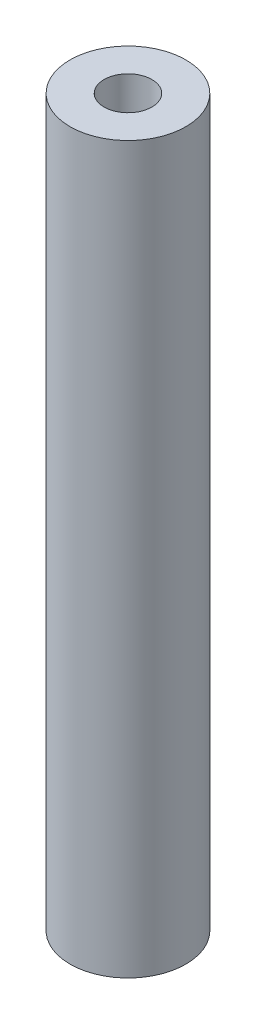
from build123d import *

# Parameters (mm, degrees)
SKETCH1_R           = 4
BOSS_EXTRUDE2_DEPTH = 50.1
SKETCH2_R           = 1.65
CUT_EXTRUDE1_DEPTH  = 8
CUT_EXTRUDE2_START  = -8
SKETCH3_R           = 1.65
CUT_EXTRUDE2_DEPTH  = 8


with BuildPart() as part:
    # Sketch1 → Boss-Extrude2 (new body)
    with BuildSketch(Plane(origin=(0, 0, 0), x_dir=(1, 0, 0), z_dir=(0, 1, 0))):
        with Locations(Location((0, 0, 0), (0, 0, 270))):
            Circle(SKETCH1_R)
    extrude(amount=BOSS_EXTRUDE2_DEPTH)

    # Sketch2 → Cut-Extrude1 (cut)
    with BuildSketch(Plane(origin=(0, 50.1, 0), x_dir=(1, 0, 0), z_dir=(0, 1, 0))):
        with Locations(Location((0, 0, 0), (0, 0, 270))):
            Circle(SKETCH2_R)
    extrude(amount=-CUT_EXTRUDE1_DEPTH, mode=Mode.SUBTRACT)

    # Sketch3 → Cut-Extrude2 (cut)
    with BuildSketch(Plane.XZ.offset(CUT_EXTRUDE2_START)):
        with Locations(Location((0, 0, 0), (0, 0, 90))):
            Circle(SKETCH3_R)
    extrude(amount=CUT_EXTRUDE2_DEPTH, mode=Mode.SUBTRACT)


solid = part.part
